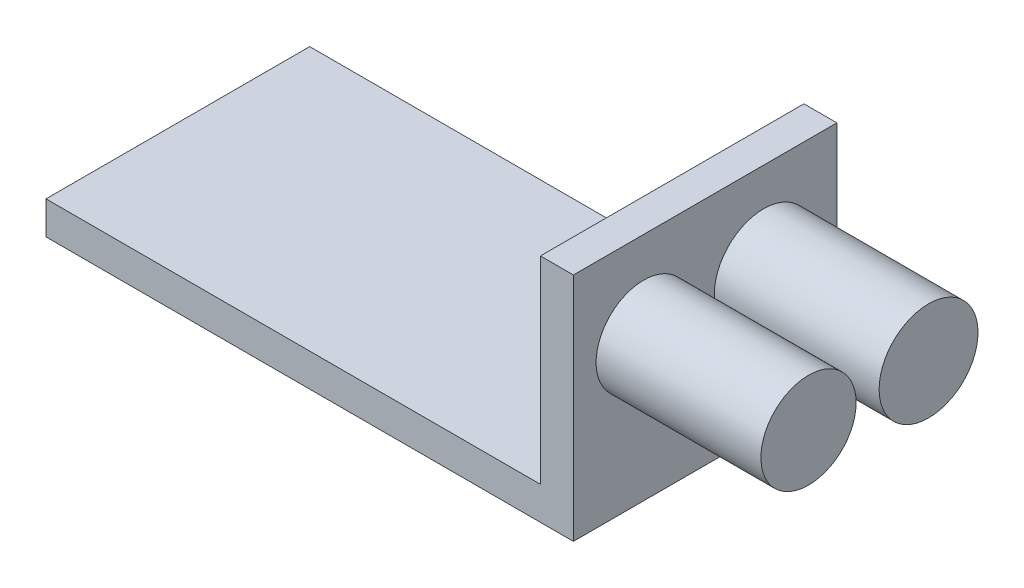
from build123d import *

# Parameters (mm, degrees)
SKETCH1_W           = 15
SKETCH1_H           = 8
BOSS_EXTRUDE1_DEPTH = 1
SKETCH2_W           = 7.993829057
SKETCH2_H           = 7
BOSS_EXTRUDE2_DEPTH = 1
SKETCH3_R           = 1.444324147
SKETCH3_R_2         = 1.5
BOSS_EXTRUDE3_DEPTH = 5


with BuildPart() as part:
    # Sketch1 → Boss-Extrude1 (new body)
    with BuildSketch(Plane(origin=(0, 0, 0), x_dir=(1, 0, 0), z_dir=(0, 1, 0))):
        Rectangle(SKETCH1_W, SKETCH1_H)
    extrude(amount=BOSS_EXTRUDE1_DEPTH)

    # Sketch2 → Boss-Extrude2 (add)
    with BuildSketch(Plane(origin=(7.5, 0, 0), x_dir=(0, 0, -1), z_dir=(1, 0, 0))):
        with Locations((-0.003085471, 3.5)):
            Rectangle(SKETCH2_W, SKETCH2_H)
    extrude(amount=BOSS_EXTRUDE2_DEPTH)

    # Sketch3 → Boss-Extrude3 (add)
    with BuildSketch(Plane(origin=(8.5, 0, 0), x_dir=(0, 0, -1), z_dir=(1, 0, 0))):
        with Locations((-1.866576137, 4.354733514)):
            Circle(SKETCH3_R)
        with Locations(Location((1.775399333, 4.354733514, 0), (0, 0, 180))):
            Circle(SKETCH3_R_2)
    extrude(amount=BOSS_EXTRUDE3_DEPTH)


solid = part.part
